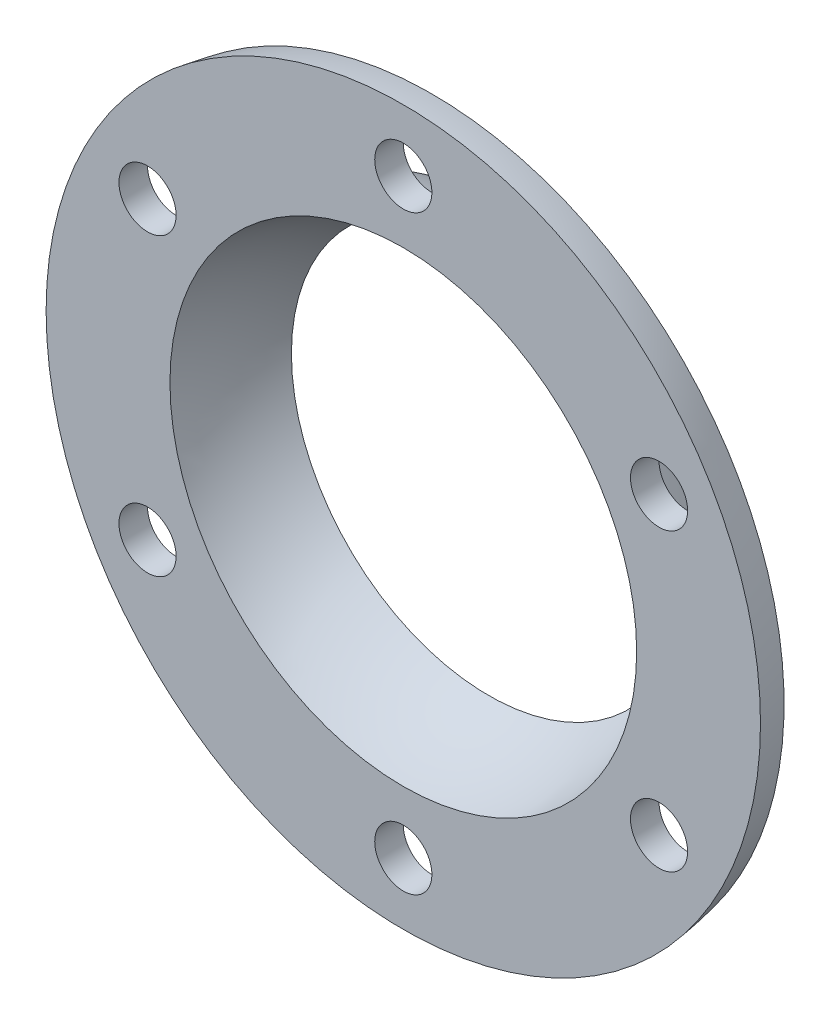
from build123d import *

# Parameters (mm, degrees)
SKETCH8_R          = 3
CUT_EXTRUDE3_DEPTH = 10
CIRPATTERN2_COUNT  = 6


with BuildPart() as part:
    # Sketch1 → Revolve1 (revolve)
    with BuildSketch(Plane(origin=(0, 0, 0), x_dir=(1, 0, 0), z_dir=(0, 1, 0))):
        with BuildLine():
            Line((24.494897428, 0), (37.494897428, 0))
            ThreePointArc((37.494897428, 0), (37.263758056, 1.505294975), (36.971875785, 3))
            Line((36.971875785, 3), (26.83281573, 3))
            ThreePointArc((26.83281573, 3), (25.72101407, 6.06478356), (24.260502346, 8.979557429))
            Line((24.260502346, 8.979557429), (20.725653382, 8.980246488))
            ThreePointArc((20.725653382, 8.980246488), (23.051806017, 4.675445176), (24.494897428, 0))
        make_face()
    revolve(axis=Axis((0, 0, -42.340685112), (0, 0, 1)))

    # Sketch8 → Cut-Extrude3 (cut)
    with BuildSketch(Plane(origin=(0, 0, -3), x_dir=(-1, 0, 0), z_dir=(0, 0, -1))):
        with Locations((0, 31)):
            Circle(SKETCH8_R)
    cut_extrude3 = extrude(amount=-CUT_EXTRUDE3_DEPTH, mode=Mode.SUBTRACT)

    # CirPattern2: Cut-Extrude3 ×6 about axis
    cirpattern2_axis = Axis((0, 0, 0), (0, 0, 1))
    for i in range(1, CIRPATTERN2_COUNT):
        add(cut_extrude3.rotate(cirpattern2_axis, i * 360 / CIRPATTERN2_COUNT), mode=Mode.SUBTRACT)


solid = part.part
